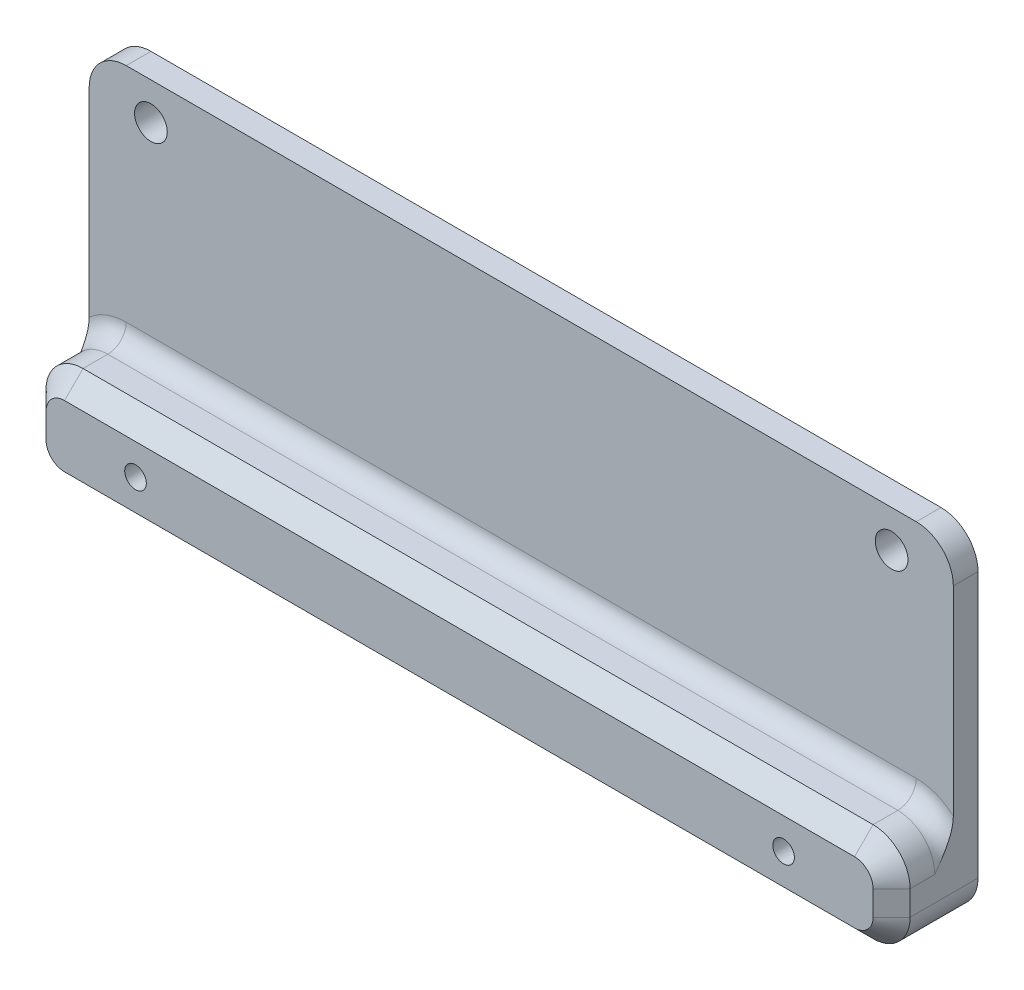
from build123d import *

# Parameters (mm, degrees)
SKETCH1_W           = 140
SKETCH1_H           = 55
SKETCH1_R           = 2.65
BOSS_EXTRUDE1_DEPTH = 4
SKETCH2_W           = 140
SKETCH2_H           = 16
BOSS_EXTRUDE2_DEPTH = 10
SKETCH3_W           = 134
SKETCH3_H           = 10
CUT_EXTRUDE1_DEPTH  = 11
CUT_EXTRUDE2_START  = -0.3
SKETCH4_R           = 1.75
CUT_EXTRUDE2_DEPTH  = 76.708223239
FILLET1_R           = 3
FILLET2_R           = 6
FILLET3_R           = 3
CHAMFER1_SIZE       = 1
CHAMFER2_SIZE       = 3


with BuildPart() as part:
    # Sketch1 → Boss-Extrude1 (new body)
    with BuildSketch(Plane.XY):
        Rectangle(SKETCH1_W, SKETCH1_H)
        with Locations((-60, 21.5)):
            Circle(SKETCH1_R, mode=Mode.SUBTRACT)
        with Locations((60, 21.5)):
            Circle(SKETCH1_R, mode=Mode.SUBTRACT)
    extrude(amount=BOSS_EXTRUDE1_DEPTH)

    # Sketch2 → Boss-Extrude2 (add)
    with BuildSketch(Plane.XY.offset(4)):
        with Locations((0, -19.5)):
            Rectangle(SKETCH2_W, SKETCH2_H)
    extrude(amount=BOSS_EXTRUDE2_DEPTH)

    # Sketch3 → Cut-Extrude1 (cut)
    with BuildSketch(Plane(origin=(0, 0, 0), x_dir=(-1, 0, 0), z_dir=(0, 0, -1))):
        with Locations((0, -19.5)):
            Rectangle(SKETCH3_W, SKETCH3_H)
    extrude(amount=-CUT_EXTRUDE1_DEPTH, mode=Mode.SUBTRACT)

    # Sketch4 → Cut-Extrude2 (cut, through all)
    with BuildSketch(Plane(origin=(0, 0, 11), x_dir=(-1, 0, 0), z_dir=(0, 0, -1)).offset(CUT_EXTRUDE2_START)):
        with Locations((52.5, -19.5)):
            Circle(SKETCH4_R)
        with Locations((-52.5, -19.5)):
            Circle(SKETCH4_R)
    extrude(amount=-CUT_EXTRUDE2_DEPTH, mode=Mode.SUBTRACT)

    # Fillet1
    fillet1_edges = [part.edges().sort_by_distance(p)[0] for p in [
        (67, -14.5, 5.5),
        (67, -24.5, 5.5),
        (-67, -24.5, 5.5),
        (-67, -14.5, 5.5),
    ]]
    fillet(fillet1_edges, radius=FILLET1_R)

    # Fillet2
    fillet2_edges = [part.edges().sort_by_distance(p)[0] for p in [
        (70, -11.5, 9),
        (-70, -11.5, 9),
        (70, -27.5, 7),
        (-70, -27.5, 7),
        (-70, 27.5, 2),
        (70, 27.5, 2),
    ]]
    fillet(fillet2_edges, radius=FILLET2_R)

    # Fillet3
    fillet3_edges = [part.edges().sort_by_distance(p)[0] for p in [
        (68.242640687, -13.257359313, 4),
        (0, -11.5, 4),
        (-68.242640687, -13.257359313, 4),
    ]]
    fillet(fillet3_edges, radius=FILLET3_R)

    # Chamfer1
    chamfer1_edges = [part.edges().sort_by_distance(p)[0] for p in [
        (0, -14.5, 11),
        (-67, -19.5, 11),
        (67, -19.5, 11),
        (0, -24.5, 11),
        (66.121320344, -15.378679656, 11),
        (66.121320344, -23.621320344, 11),
        (-66.121320344, -23.621320344, 11),
        (-66.121320344, -15.378679656, 11),
    ]]
    chamfer(chamfer1_edges, length=CHAMFER1_SIZE)

    # Chamfer2
    chamfer2_edges = [part.edges().sort_by_distance(p)[0] for p in [
        (-70, -19.5, 14),
        (0, -11.5, 14),
        (70, -19.5, 14),
        (0, -27.5, 14),
        (68.242640687, -25.742640687, 14),
        (68.242640687, -13.257359313, 14),
        (-68.242640687, -25.742640687, 14),
        (-68.242640687, -13.257359313, 14),
    ]]
    chamfer(chamfer2_edges, length=CHAMFER2_SIZE)


solid = part.part
